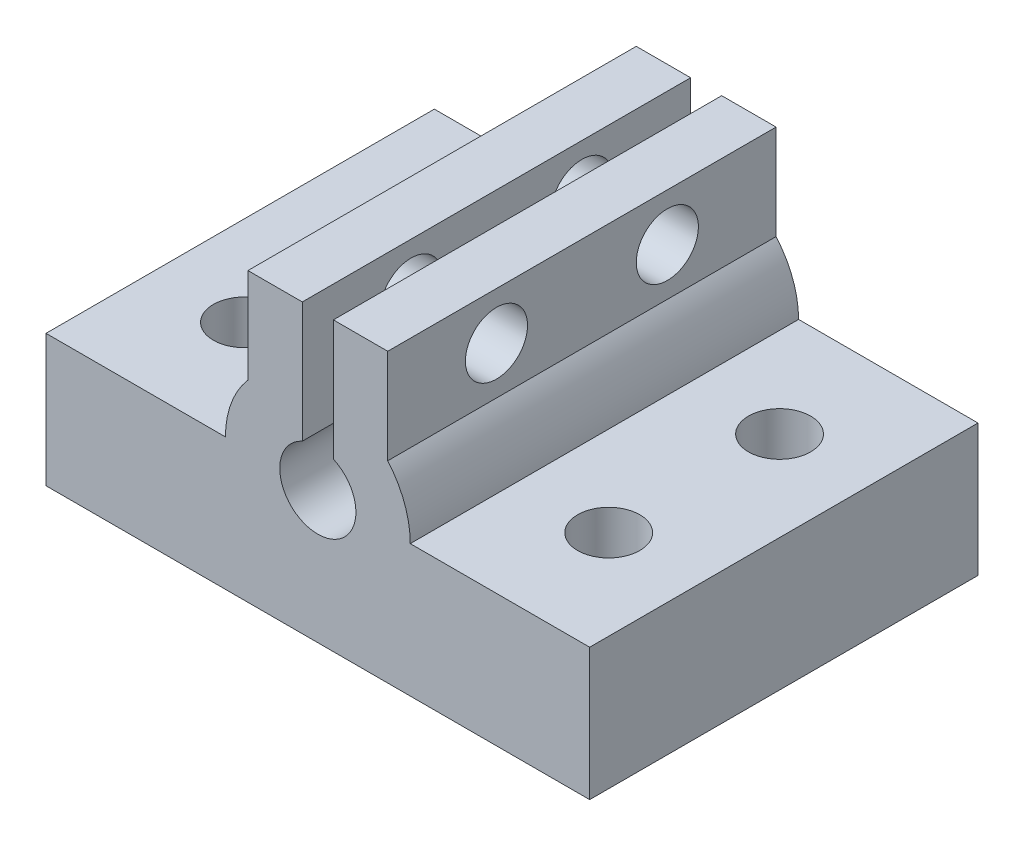
from build123d import *

# Parameters (mm, degrees)
BOSS_EXTRUDE1_DEPTH = 25
CUT_EXTRUDE1_REACH  = 40.095
SKETCH2_R           = 2
CUT_EXTRUDE2_REACH  = 46.159
SKETCH3_R           = 2


with BuildPart() as part:
    # Sketch1 → Boss-Extrude1 (new body)
    with BuildSketch(Plane.XY):
        with BuildLine():
            Line((0, 0), (35, 0))
            Line((35, 0), (35, 8.5))
            Line((35, 8.5), (23.45, 8.5))
            ThreePointArc((23.45, 8.5), (23.075728652, 10.576956909), (22, 12.392621225))
            Line((22, 12.392621225), (22, 18.5))
            Line((22, 18.5), (18.5, 18.5))
            Line((18.5, 18.5), (18.5, 10.736626925))
            ThreePointArc((18.5, 10.736626925), (17.5, 6.05), (16.5, 10.736626925))
            Line((16.5, 10.736626925), (16.5, 18.5))
            Line((16.5, 18.5), (13, 18.5))
            Line((13, 18.5), (13, 12.392621225))
            ThreePointArc((13, 12.392621225), (11.924271348, 10.576956909), (11.55, 8.5))
            Line((11.55, 8.5), (0, 8.5))
            Line((0, 8.5), (0, 0))
        make_face()
    extrude(amount=BOSS_EXTRUDE1_DEPTH)

    # Cut-Extrude1: up to this face of the body (flat: up to its plane)
    cut_extrude1_end = Plane(part.part.faces().sort_by_distance((13, 15.446310612, 12.5))[0])
    # Sketch2 → Cut-Extrude1 (cut, up to the picked face)
    with BuildSketch(Plane(origin=(22, 0, 0), x_dir=(0, 0, -1), z_dir=(1, 0, 0)), mode=Mode.PRIVATE) as cut_extrude1_sk1:
        with Locations(Location((-18, 15.446310612, 0), (0, 0, 90))):
            Circle(SKETCH2_R)
    cut_extrude1_tool1 = split(extrude(cut_extrude1_sk1.sketch, amount=-CUT_EXTRUDE1_REACH, mode=Mode.PRIVATE), bisect_by=cut_extrude1_end, keep=Keep.BOTH, mode=Mode.PRIVATE)
    # Sketch2 → Cut-Extrude1 (cut, up to the picked face)
    with BuildSketch(Plane(origin=(22, 0, 0), x_dir=(0, 0, -1), z_dir=(1, 0, 0)), mode=Mode.PRIVATE) as cut_extrude1_sk2:
        with Locations(Location((-7, 15.446310612, 0), (0, 0, 90))):
            Circle(SKETCH2_R)
    cut_extrude1_tool2 = split(extrude(cut_extrude1_sk2.sketch, amount=-CUT_EXTRUDE1_REACH, mode=Mode.PRIVATE), bisect_by=cut_extrude1_end, keep=Keep.BOTH, mode=Mode.PRIVATE)
    add(cut_extrude1_tool1.solids().sort_by(Axis((22, 15.446311, 18), (-1, 0, 0)))[0], mode=Mode.SUBTRACT)
    add(cut_extrude1_tool2.solids().sort_by(Axis((22, 15.446311, 7), (-1, 0, 0)))[0], mode=Mode.SUBTRACT)

    # Sketch3 → Cut-Extrude2 (cut, up to next)
    with BuildSketch(Plane(origin=(0, 8.5, 0), x_dir=(1, 0, 0), z_dir=(0, 1, 0)), mode=Mode.PRIVATE) as cut_extrude2_sk1:
        with Locations(Location((29.225, -18, 0), (0, 0, 180))):
            Circle(SKETCH3_R)
    cut_extrude2_tool1 = extrude(cut_extrude2_sk1.sketch, amount=-CUT_EXTRUDE2_REACH, mode=Mode.PRIVATE) & part.part
    # Sketch3 → Cut-Extrude2 (cut, up to next)
    with BuildSketch(Plane(origin=(0, 8.5, 0), x_dir=(1, 0, 0), z_dir=(0, 1, 0)), mode=Mode.PRIVATE) as cut_extrude2_sk2:
        with Locations(Location((29.225, -7, 0), (0, 0, 180))):
            Circle(SKETCH3_R)
    cut_extrude2_tool2 = extrude(cut_extrude2_sk2.sketch, amount=-CUT_EXTRUDE2_REACH, mode=Mode.PRIVATE) & part.part
    # Sketch3 → Cut-Extrude2 (cut, up to next)
    with BuildSketch(Plane(origin=(0, 8.5, 0), x_dir=(1, 0, 0), z_dir=(0, 1, 0)), mode=Mode.PRIVATE) as cut_extrude2_sk3:
        with Locations(Location((5.775, -7, 0), (0, 0, 270))):
            Circle(SKETCH3_R)
    cut_extrude2_tool3 = extrude(cut_extrude2_sk3.sketch, amount=-CUT_EXTRUDE2_REACH, mode=Mode.PRIVATE) & part.part
    # Sketch3 → Cut-Extrude2 (cut, up to next)
    with BuildSketch(Plane(origin=(0, 8.5, 0), x_dir=(1, 0, 0), z_dir=(0, 1, 0)), mode=Mode.PRIVATE) as cut_extrude2_sk4:
        with Locations(Location((5.775, -18, 0), (0, 0, 270))):
            Circle(SKETCH3_R)
    cut_extrude2_tool4 = extrude(cut_extrude2_sk4.sketch, amount=-CUT_EXTRUDE2_REACH, mode=Mode.PRIVATE) & part.part
    add(cut_extrude2_tool1.solids().sort_by_distance((29.225, 8.5, 18))[0], mode=Mode.SUBTRACT)
    add(cut_extrude2_tool2.solids().sort_by_distance((29.225, 8.5, 7))[0], mode=Mode.SUBTRACT)
    add(cut_extrude2_tool3.solids().sort_by_distance((5.775, 8.5, 7))[0], mode=Mode.SUBTRACT)
    add(cut_extrude2_tool4.solids().sort_by_distance((5.775, 8.5, 18))[0], mode=Mode.SUBTRACT)


solid = part.part
